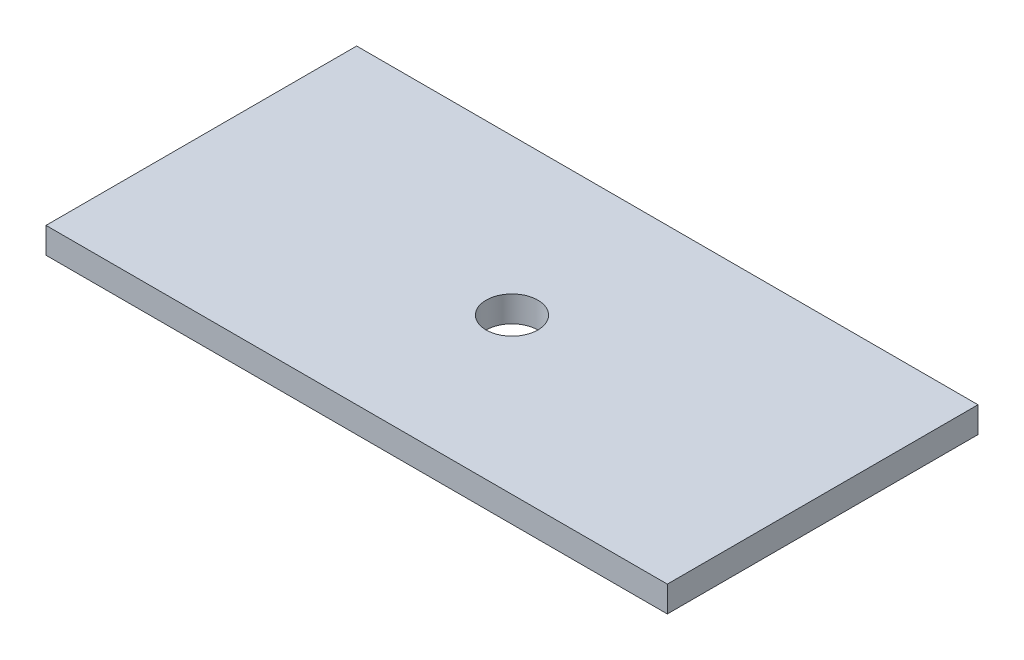
from build123d import *

# Parameters (mm, degrees)
SKETCH1_W           = 152.4
SKETCH1_H           = 76.2
SKETCH1_R           = 6.35
BOSS_EXTRUDE1_DEPTH = 6.35


with BuildPart() as part:
    # Sketch1 → Boss-Extrude1 (new body)
    with BuildSketch(Plane(origin=(0, 0, 0), x_dir=(1, 0, 0), z_dir=(0, 1, 0))):
        Rectangle(SKETCH1_W, SKETCH1_H)
        with Locations(Location((0, 0, 0), (0, 0, 270))):
            Circle(SKETCH1_R, mode=Mode.SUBTRACT)
    extrude(amount=BOSS_EXTRUDE1_DEPTH)


solid = part.part
